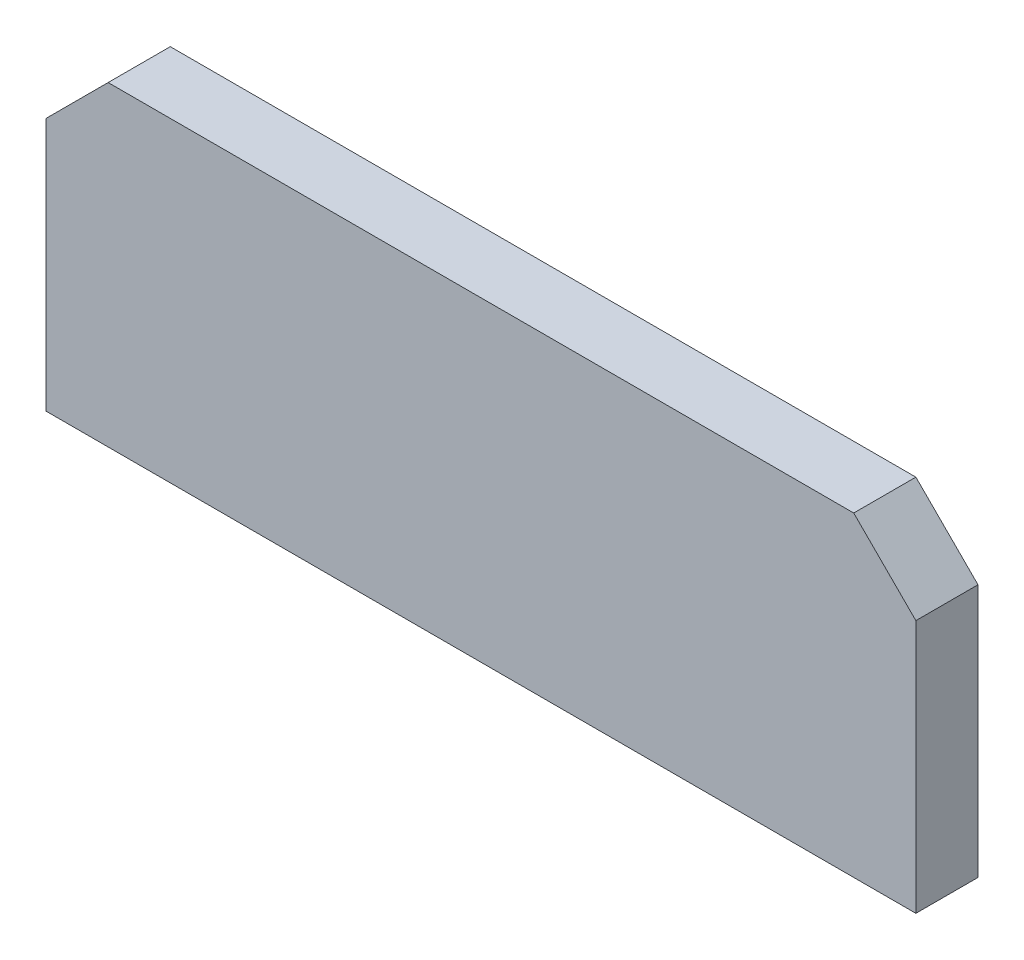
from build123d import *

# Parameters (mm, degrees)
SALIENTE_EXTRUIR1_DEPTH = 10


with BuildPart() as part:
    # Croquis1 → Saliente-Extruir1 (new body)
    with BuildSketch(Plane.XY):
        Polygon((-60, 25.4), (-70, 15.4), (-70, -25.4), (70, -25.4), (70, 15.4), (60, 25.4), align=None)
    extrude(amount=SALIENTE_EXTRUIR1_DEPTH)


solid = part.part
